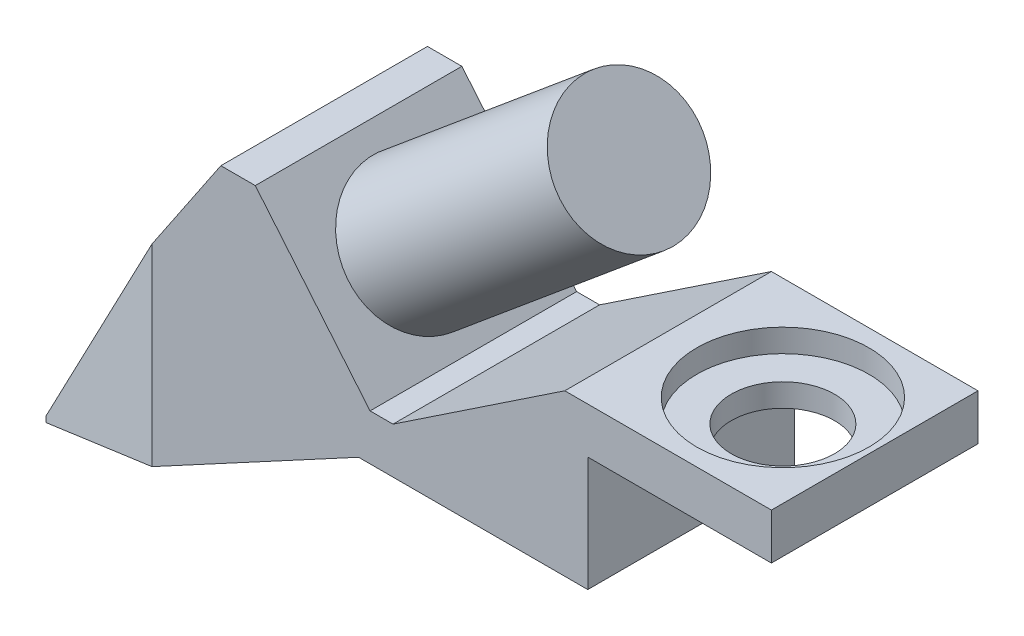
from build123d import *

# Parameters (mm, degrees)
BOSS_EXTRUDE1_DEPTH = 9
SKETCH2_R           = 2.25
CUT_EXTRUDE1_DEPTH  = 16.5
SKETCH2_3_R         = 3.75
SKETCH2_3_R_2       = 2.25
CUT_EXTRUDE2_DEPTH  = 1
SKETCH3_R           = 3
BOSS_EXTRUDE2_DEPTH = 12


with BuildPart() as part:
    # Sketch1 → Boss-Extrude1 (new body)
    with BuildSketch(Plane.XY):
        Polygon((0, 0), (17.616685226, 9.5), (27.6, 9.5), (27.6, 14.5), (35.6, 14.5), (35.6, 16.5), (26.6, 16.5), (19.116685226, 11.5), (18.116685226, 11.5), (13.116685226, 17.5), (11.616685226, 17.5), (0, 0.25), align=None)
    extrude(amount=BOSS_EXTRUDE1_DEPTH)

    # Sketch2 → Cut-Extrude1 (cut)
    with BuildSketch(Plane(origin=(0, 16.5, 0), x_dir=(1, 0, 0), z_dir=(0, 1, 0))):
        with Locations(Location((31.6, -4.5, 0), (0, 0, 270))):
            Circle(SKETCH2_R)
        Polygon((0, 0), (0, -4), (8.616685226, 0), align=None)
        Polygon((0, -5), (8.616685226, -9), (0, -9), align=None)
    extrude(amount=-CUT_EXTRUDE1_DEPTH, mode=Mode.SUBTRACT)

    # Sketch2<3> → Cut-Extrude2 (cut)
    with BuildSketch(Plane(origin=(0, 16.5, 0), x_dir=(1, 0, 0), z_dir=(0, 1, 0))):
        with Locations(Location((31.6, -4.5, 0), (0, 0, 270))):
            Circle(SKETCH2_3_R)
        with Locations(Location((31.6, -4.5, 0), (0, 0, 270))):
            Circle(SKETCH2_3_R_2, mode=Mode.SUBTRACT)
    extrude(amount=-CUT_EXTRUDE2_DEPTH, mode=Mode.SUBTRACT)

    # Sketch3 → Boss-Extrude2 (add)
    with BuildSketch(Plane(origin=(16.347551937, 13.622959947, 0), x_dir=(0, 0, -1), z_dir=(0.768221279597376, 0.6401843996644799, 0))):
        with Locations(Location((-4.5, 1.046775136, 0), (0, 0, 270))):
            Circle(SKETCH3_R)
    extrude(amount=BOSS_EXTRUDE2_DEPTH)


solid = part.part
